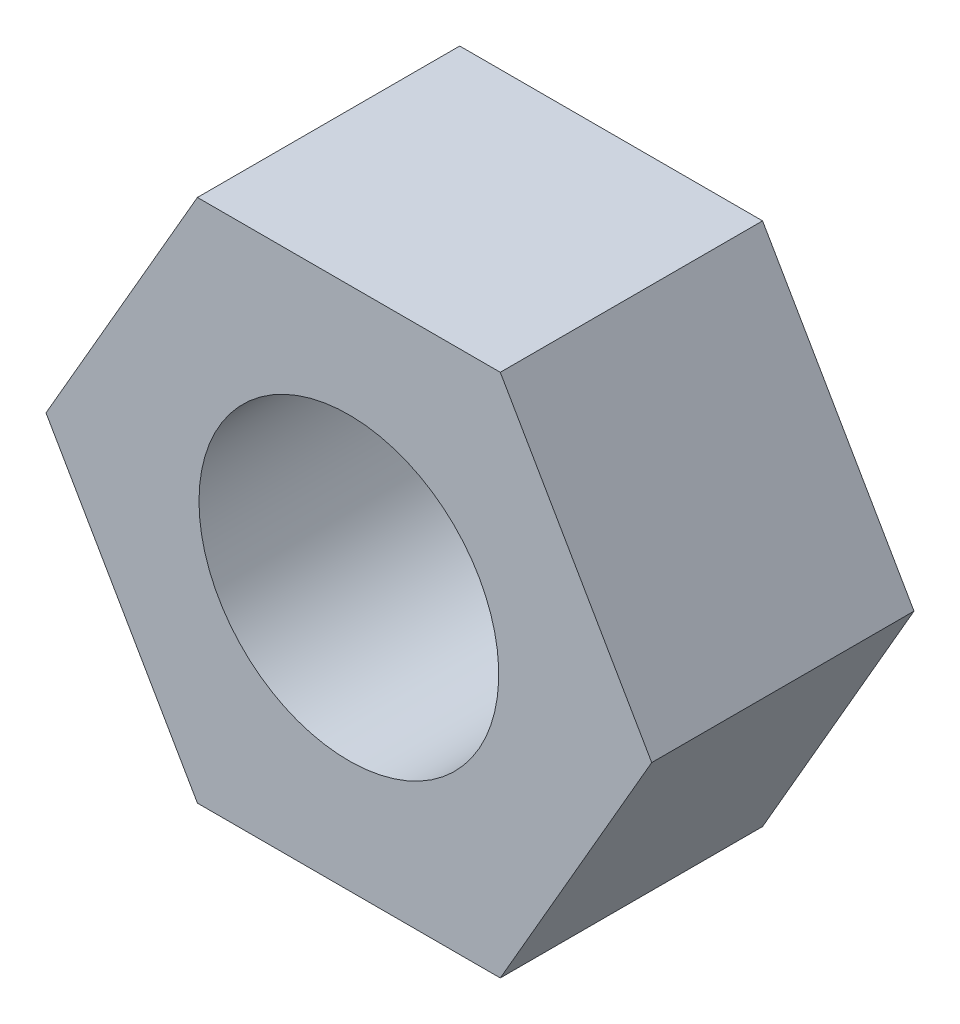
from build123d import *

# Parameters (mm, degrees)
SKETCH1_R           = 101.6
BOSS_EXTRUDE1_DEPTH = 177.8


with BuildPart() as part:
    # Sketch1 → Boss-Extrude1 (new body)
    with BuildSketch(Plane.XY.offset(177.8)):
        Polygon((-102.652877862, -177.8), (102.652877862, -177.8), (205.305755724, 0), (102.652877862, 177.8), (-102.652877862, 177.8), (-205.305755724, 0), align=None)
        with Locations(Location((0, 0, 0), (0, 0, 180))):
            Circle(SKETCH1_R, mode=Mode.SUBTRACT)
    extrude(amount=-BOSS_EXTRUDE1_DEPTH)


solid = part.part
